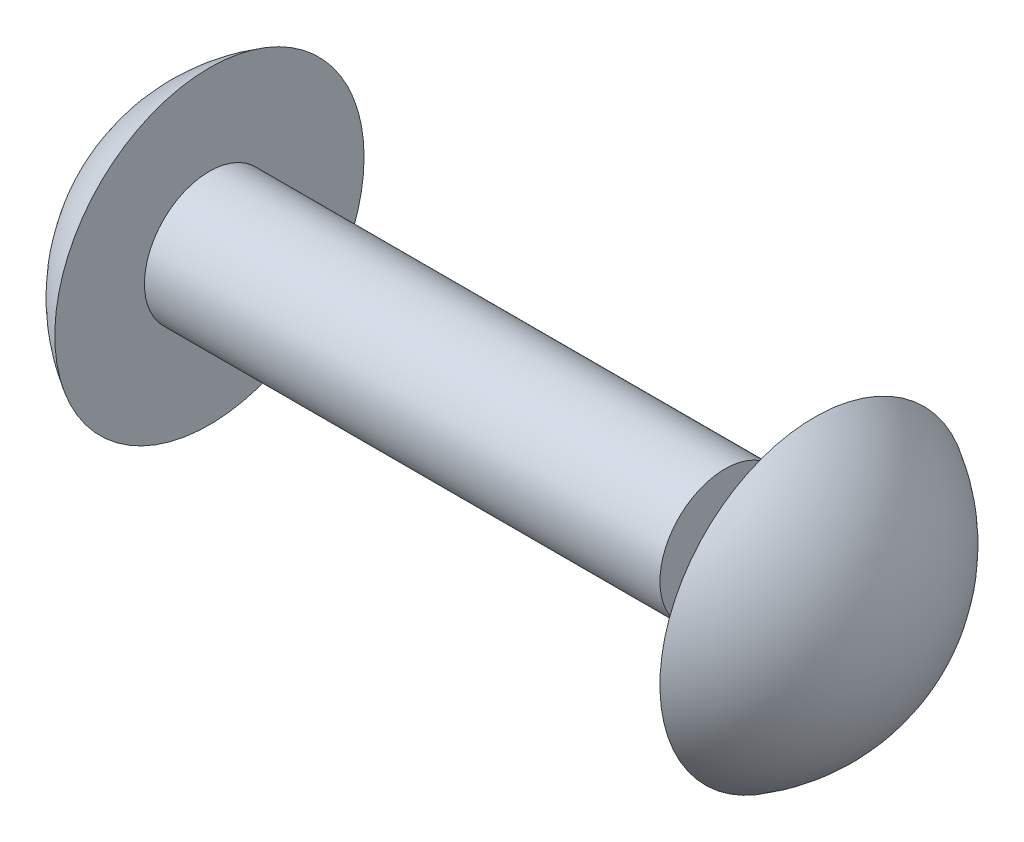
from build123d import *

# Parameters (mm, degrees)
SKETCH2_R           = 1.45
BOSS_EXTRUDE1_DEPTH = 5.75
CIRPATTERN3_COUNT   = 2


with BuildPart() as part:
    # Sketch2 → Boss-Extrude1 (new, symmetric)
    with BuildSketch(Plane.YZ):
        with Locations(Location((0, 0, 0), (0, 0, 270))):
            Circle(SKETCH2_R)
    extrude(amount=BOSS_EXTRUDE1_DEPTH, both=True)


with BuildPart() as body_2:
    # Sketch3 → Revolve1 (revolve)
    with BuildSketch(Plane(origin=(0, 0, 0), x_dir=(0, 1, 0), z_dir=(0, 0, 1))):
        with BuildLine():
            Line((0, 5.75), (0, 7.75))
            ThreePointArc((0, 7.75), (1.993896938, 7.213847218), (3.45, 5.75))
            Line((3.45, 5.75), (0, 5.75))
        make_face()
    revolve(axis=Axis((-5.75, 0, 0), (-1, 0, 0)))


with BuildPart() as cirpattern3_1:
    # CirPattern3: pattern copy
    add(body_2.part.rotate(Axis((1, 0, 0), (0, 0, 1)), 1 * 360 / CIRPATTERN3_COUNT))


solid = Compound([part.part, body_2.part, cirpattern3_1.part])
